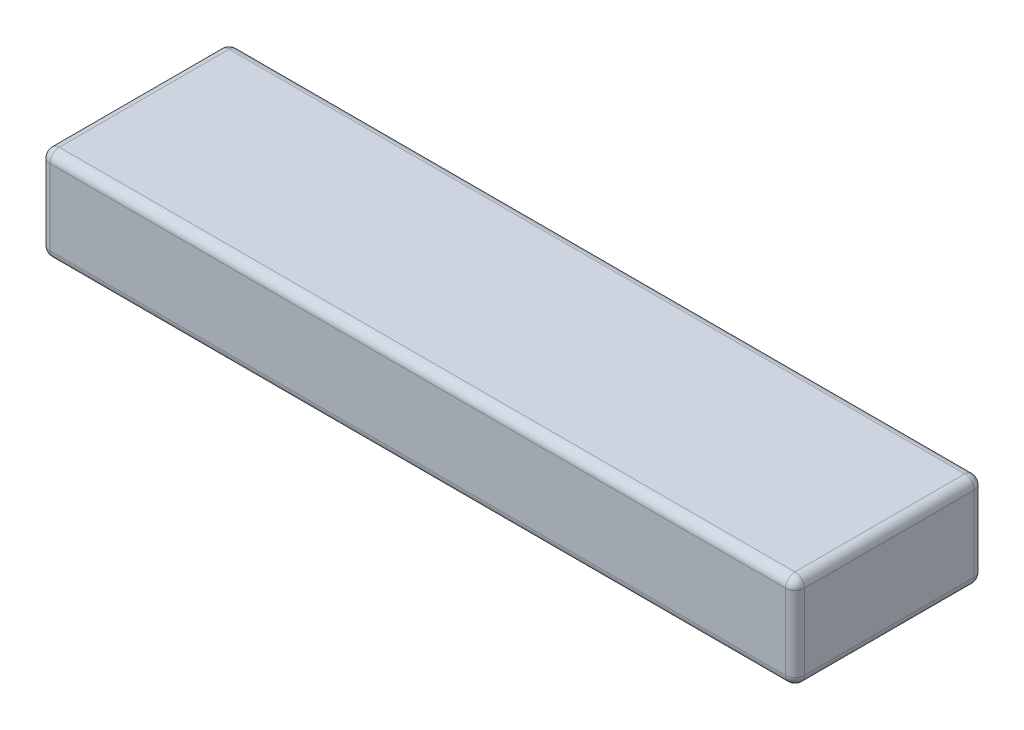
from build123d import *

# Parameters (mm, degrees)
SKETCH1_W           = 40
SKETCH1_H           = 10
BOSS_EXTRUDE1_DEPTH = 5
FILLET1_R           = 0.5


with BuildPart() as part:
    # Sketch1 → Boss-Extrude1 (new body)
    with BuildSketch(Plane(origin=(0, 0, 0), x_dir=(1, 0, 0), z_dir=(0, 1, 0))):
        Rectangle(SKETCH1_W, SKETCH1_H)
    extrude(amount=BOSS_EXTRUDE1_DEPTH)

    # Fillet1
    fillet1_edges = [part.edges().sort_by_distance(p)[0] for p in [
        (20, 5, 0),
        (0, 5, -5),
        (-20, 5, 0),
        (0, 0, -5),
        (20, 0, 0),
        (0, 0, 5),
        (-20, 0, 0),
        (-20, 2.5, -5),
        (20, 2.5, -5),
        (20, 2.5, 5),
        (-20, 2.5, 5),
        (0, 5, 5),
    ]]
    fillet(fillet1_edges, radius=FILLET1_R)


solid = part.part
